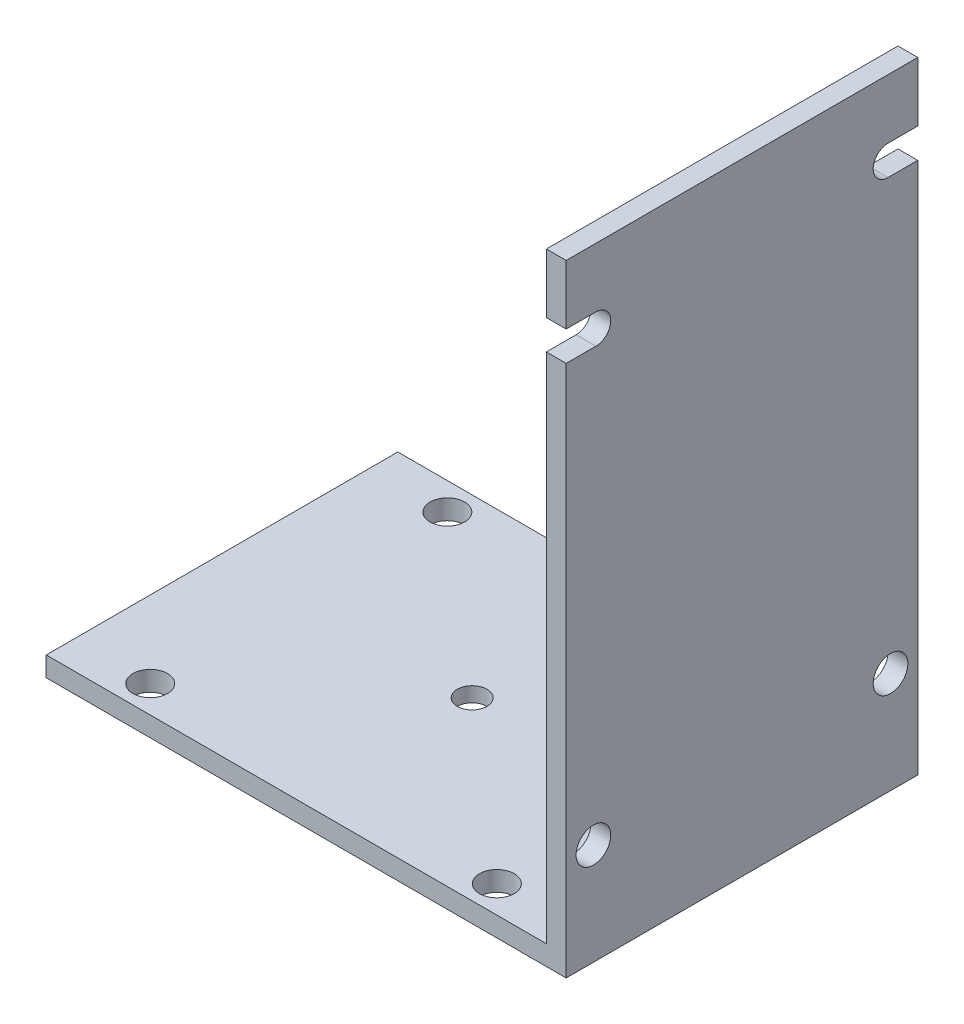
from build123d import *

# Parameters (mm, degrees)
SALIENTE_EXTRUIR1_DEPTH = 4
CROQUIS2_W              = 4
CROQUIS2_H              = 71
SALIENTE_EXTRUIR2_DEPTH = 125.5
CORTAR_EXTRUIR2_START   = 55.720628
CROQUIS3_R              = 3.5
CORTAR_EXTRUIR2_DEPTH   = 59.720627748
CROQUIS4_R              = 3
CORTAR_EXTRUIR3_DEPTH   = 4
CROQUIS5_R              = 12.25
CORTAR_EXTRUIR4_DEPTH   = 1


with BuildPart() as part:
    # Croquis1 → Saliente-Extruir1 (new body)
    with BuildSketch(Plane(origin=(0, 0, 0), x_dir=(1, 0, 0), z_dir=(0, 1, 0))):
        with BuildLine():
            Line((-29.779372252, -36), (40.220627748, -36))
            Line((40.220627748, -36), (40.220627748, -34))
            ThreePointArc((40.220627748, -34), (37.745754014, -28.025126266), (43.720627748, -30.5))
            Line((43.720627748, -30.5), (55.720627748, -30.5))
            Line((55.720627748, -30.5), (55.720627748, 29.5))
            Line((55.720627748, 29.5), (43.720627748, 29.5))
            ThreePointArc((43.720627748, 29.5), (37.745754014, 27.025126266), (40.220627748, 33))
            Line((40.220627748, 33), (40.220627748, 35))
            Line((40.220627748, 35), (-29.779372252, 35))
            Line((-29.779372252, 35), (-29.779372252, 33))
            ThreePointArc((-29.779372252, 33), (-27.304498518, 31.974873734), (-26.279372252, 29.5))
            ThreePointArc((-26.279372252, 29.5), (-29.779372252, 26), (-33.279372252, 29.5))
            Line((-33.279372252, 29.5), (-45.279372252, 29.5))
            Line((-45.279372252, 29.5), (-45.279372252, -30.5))
            Line((-45.279372252, -30.5), (-33.279372252, -30.5))
            ThreePointArc((-33.279372252, -30.5), (-29.779372252, -27), (-26.279372252, -30.5))
            ThreePointArc((-26.279372252, -30.5), (-27.304498518, -32.974873734), (-29.779372252, -34))
            Line((-29.779372252, -34), (-29.779372252, -36))
        make_face()
        with BuildLine():
            Line((-45.279372252, -36), (-29.779372252, -36))
            Line((-29.779372252, -36), (-29.779372252, -34))
            ThreePointArc((-29.779372252, -34), (-32.254245986, -32.974873734), (-33.279372252, -30.5))
            Line((-33.279372252, -30.5), (-45.279372252, -30.5))
            Line((-45.279372252, -30.5), (-45.279372252, -36))
        make_face()
        with BuildLine():
            Line((40.220627748, -34), (40.220627748, -36))
            Line((40.220627748, -36), (55.720627748, -36))
            Line((55.720627748, -36), (55.720627748, -30.5))
            Line((55.720627748, -30.5), (43.720627748, -30.5))
            ThreePointArc((43.720627748, -30.5), (42.695501482, -32.974873734), (40.220627748, -34))
        make_face()
        with BuildLine():
            Line((43.720627748, 29.5), (55.720627748, 29.5))
            Line((55.720627748, 29.5), (55.720627748, 35))
            Line((55.720627748, 35), (40.220627748, 35))
            Line((40.220627748, 35), (40.220627748, 33))
            ThreePointArc((40.220627748, 33), (42.695501482, 31.974873734), (43.720627748, 29.5))
        make_face()
        with BuildLine():
            Line((-45.279372252, 35), (-45.279372252, 29.5))
            Line((-45.279372252, 29.5), (-33.279372252, 29.5))
            ThreePointArc((-33.279372252, 29.5), (-32.254245986, 31.974873734), (-29.779372252, 33))
            Line((-29.779372252, 33), (-29.779372252, 35))
            Line((-29.779372252, 35), (-45.279372252, 35))
        make_face()
    extrude(amount=SALIENTE_EXTRUIR1_DEPTH)

    # Croquis2 → Saliente-Extruir2 (add)
    with BuildSketch(Plane(origin=(0, 0, 0), x_dir=(1, 0, 0), z_dir=(0, 1, 0))):
        with Locations((57.720627748, -0.5)):
            Rectangle(CROQUIS2_W, CROQUIS2_H)
    extrude(amount=SALIENTE_EXTRUIR2_DEPTH)

    # Croquis3 → Cortar-Extruir2 (cut)
    with BuildSketch(Plane(origin=(0, 0, 0), x_dir=(0, 0, -1), z_dir=(1, 0, 0)).offset(CORTAR_EXTRUIR2_START)):
        with BuildLine():
            ThreePointArc((29, 113.5), (26.878679656, 112.621320344), (26, 110.5))
            Line((26, 110.5), (35, 110.5))
            Line((35, 110.5), (35, 113.5))
            Line((35, 113.5), (29, 113.5))
        make_face()
        with BuildLine():
            ThreePointArc((26, 110.5), (26.878679656, 108.378679656), (29, 107.5))
            Line((29, 107.5), (35, 107.5))
            Line((35, 107.5), (35, 110.5))
            Line((35, 110.5), (26, 110.5))
        make_face()
        with BuildLine():
            Line((-36, 110.5), (-27, 110.5))
            ThreePointArc((-27, 110.5), (-27.878679656, 112.621320344), (-30, 113.5))
            Line((-30, 113.5), (-36, 113.5))
            Line((-36, 113.5), (-36, 110.5))
        make_face()
        with BuildLine():
            ThreePointArc((-30, 107.5), (-27.878679656, 108.378679656), (-27, 110.5))
            Line((-27, 110.5), (-36, 110.5))
            Line((-36, 110.5), (-36, 107.5))
            Line((-36, 107.5), (-30, 107.5))
        make_face()
        with Locations(Location((29.5, 20.5, 0), (0, 0, 180))):
            Circle(CROQUIS3_R)
        with Locations(Location((-30.5, 20.5, 0), (0, 0, 180))):
            Circle(CROQUIS3_R)
    extrude(amount=CORTAR_EXTRUIR2_DEPTH, mode=Mode.SUBTRACT)

    # Croquis4 → Cortar-Extruir3 (cut)
    with BuildSketch(Plane(origin=(0, 4, 0), x_dir=(1, 0, 0), z_dir=(0, 1, 0))):
        with Locations(Location((5.220627748, -0.5, 0), (0, 0, 270))):
            Circle(CROQUIS4_R)
    extrude(amount=-CORTAR_EXTRUIR3_DEPTH, mode=Mode.SUBTRACT)

    # Croquis5 → Cortar-Extruir4 (cut)
    with BuildSketch(Plane.XZ):
        with Locations(Location((5.220627748, 0.5, 0), (0, 0, 270))):
            Circle(CROQUIS5_R)
    extrude(amount=-CORTAR_EXTRUIR4_DEPTH, mode=Mode.SUBTRACT)


solid = part.part
